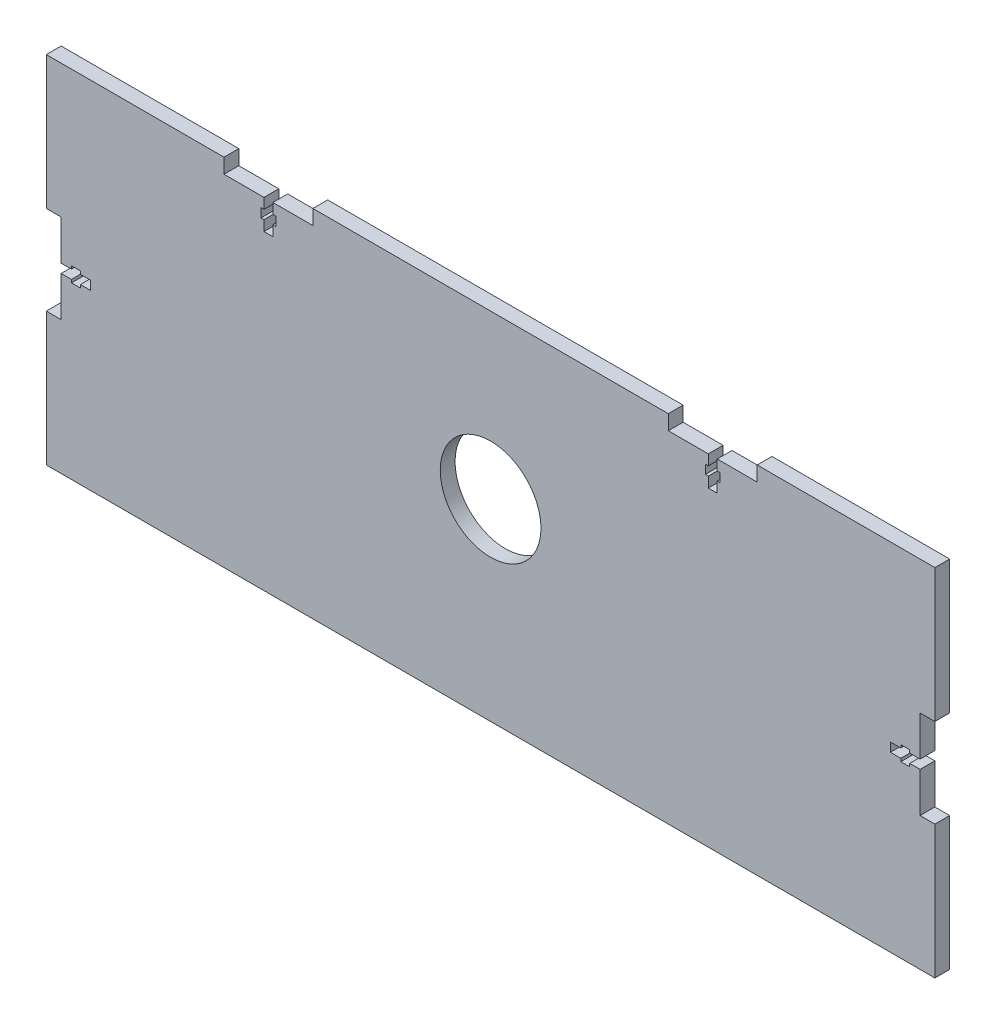
from build123d import *

# Parameters (mm, degrees)
BOSS_EXTRU_1_DEPTH      = 5
ESQUISSE2_R             = 17
ENL_V_MAT_EXTRU_1_DEPTH = 162.632298752


with BuildPart() as part:
    # Esquisse1 → Boss.-Extru.1 (new body)
    with BuildSketch(Plane.XY):
        Polygon((-90, 60), (-150, 60), (-150, 15), (-145, 15), (-145, 1.5), (-141.5, 1.5), (-141.5, 2.5), (-138.5, 2.5), (-138.5, 1.5), (-135, 1.5), (-135, -1.5), (-138.5, -1.5), (-138.5, -2.5), (-141.5, -2.5), (-141.5, -1.5), (-145, -1.5), (-145, -15), (-150, -15), (-150, -60), (-90, -60), (-60, -60), (60, -60), (90, -60), (150, -60), (150, -15), (145, -15), (145, -1.5), (141.5, -1.5), (141.5, -2.5), (138.5, -2.5), (138.5, -1.5), (135, -1.5), (135, 1.5), (138.5, 1.5), (138.5, 2.5), (141.5, 2.5), (141.5, 1.5), (145, 1.5), (145, 15), (150, 15), (150, 60), (90, 60), (90, 55), (76.5, 55), (76.5, 51.5), (77.5, 51.5), (77.5, 48.5), (76.5, 48.5), (76.5, 45), (73.5, 45), (73.5, 48.5), (72.5, 48.5), (72.5, 51.5), (73.5, 51.5), (73.5, 55), (60, 55), (60, 60), (-60, 60), (-60, 55), (-73.5, 55), (-73.5, 51.5), (-72.5, 51.5), (-72.5, 48.5), (-73.5, 48.5), (-73.5, 45), (-76.5, 45), (-76.5, 48.5), (-77.5, 48.5), (-77.5, 51.5), (-76.5, 51.5), (-76.5, 55), (-90, 55), align=None)
    extrude(amount=BOSS_EXTRU_1_DEPTH)

    # Esquisse2 → Enlèv. mat.-Extru.1 (cut, through all)
    with BuildSketch(Plane(origin=(0, 0, 0), x_dir=(-1, 0, 0), z_dir=(0, 0, -1))):
        with Locations((0, 5)):
            Circle(ESQUISSE2_R)
    extrude(amount=-ENL_V_MAT_EXTRU_1_DEPTH, mode=Mode.SUBTRACT)


solid = part.part
